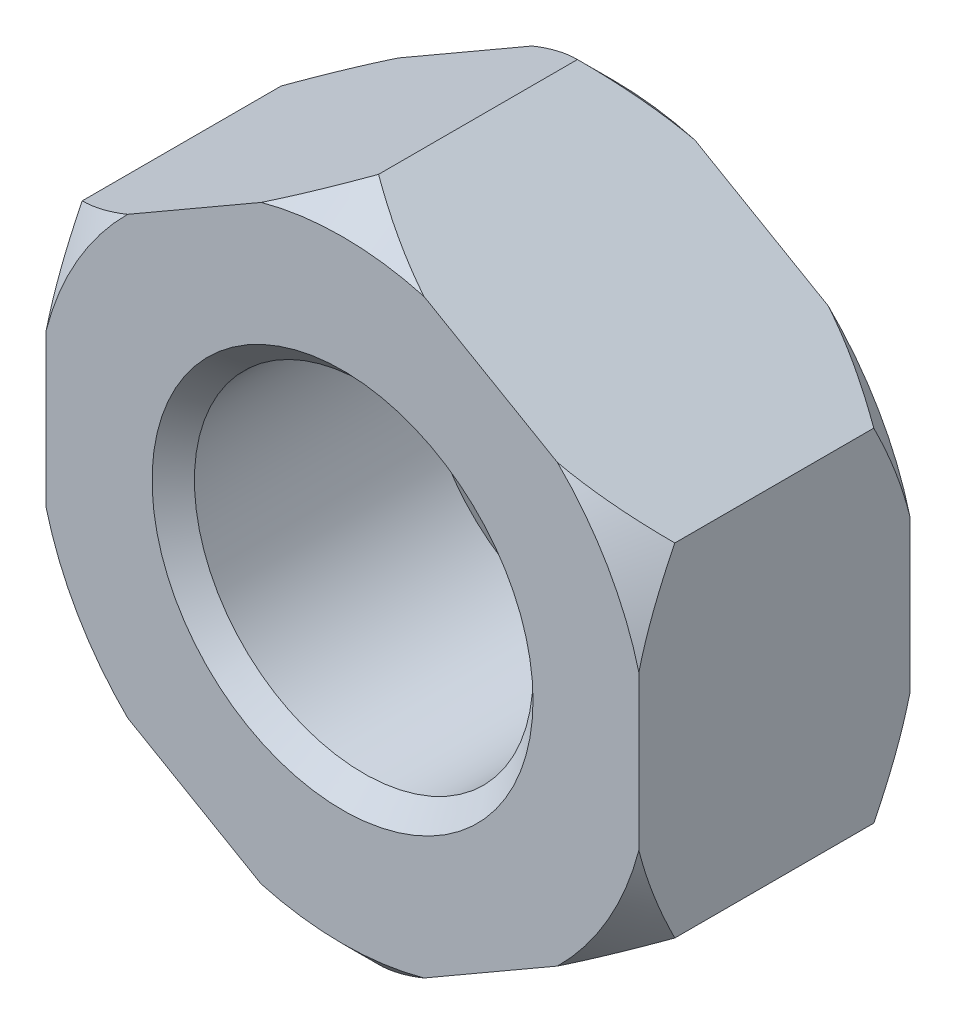
from build123d import *

# Parameters (mm, degrees)
EXTRUDE_1_DEPTH     = 3.2
SKETCH_2_R          = 2
CUT_EXTRUDE_1_DEPTH = 7.23083729
CHAMFER_1_SIZE      = 0.25


with BuildPart() as part:
    # Эскиз1 → Вытянуть1 (new body)
    with BuildSketch(Plane.XY):
        Polygon((0, 4.041451884), (-3.5, 2.020725942), (-3.5, -2.020725942), (0, -4.041451884), (3.5, -2.020725942), (3.5, 2.020725942), align=None)
    extrude(amount=EXTRUDE_1_DEPTH)

    # Эскиз15 → Вырез-Повернуть1 (revolve, cut)
    with BuildSketch(Plane(origin=(0, 0, 0), x_dir=(0, 0, -1), z_dir=(1, 0, 0))):
        Polygon((-3.2, 4.041451884), (-3.2, 3.616451884), (-2.775, 4.041451884), align=None)
        Polygon((-0.425, 4.041451884), (0, 4.041451884), (0, 3.616451884), align=None)
    revolve(axis=Axis((0, 0, 2.633835381), (0, 0, -1)), mode=Mode.SUBTRACT)

    # Эскиз2 → Вырез-Вытянуть1 (cut, through all)
    with BuildSketch(Plane(origin=(0, 0, 0), x_dir=(-1, 0, 0), z_dir=(0, 0, -1))):
        Circle(SKETCH_2_R)
    extrude(amount=-CUT_EXTRUDE_1_DEPTH, mode=Mode.SUBTRACT)

    # Фаска1
    chamfer_1_edges = [part.edges().sort_by_distance(p)[0] for p in [
        (2, 0, 3.2),
        (2, 0, 0),
    ]]
    chamfer(chamfer_1_edges, length=CHAMFER_1_SIZE)


solid = part.part
